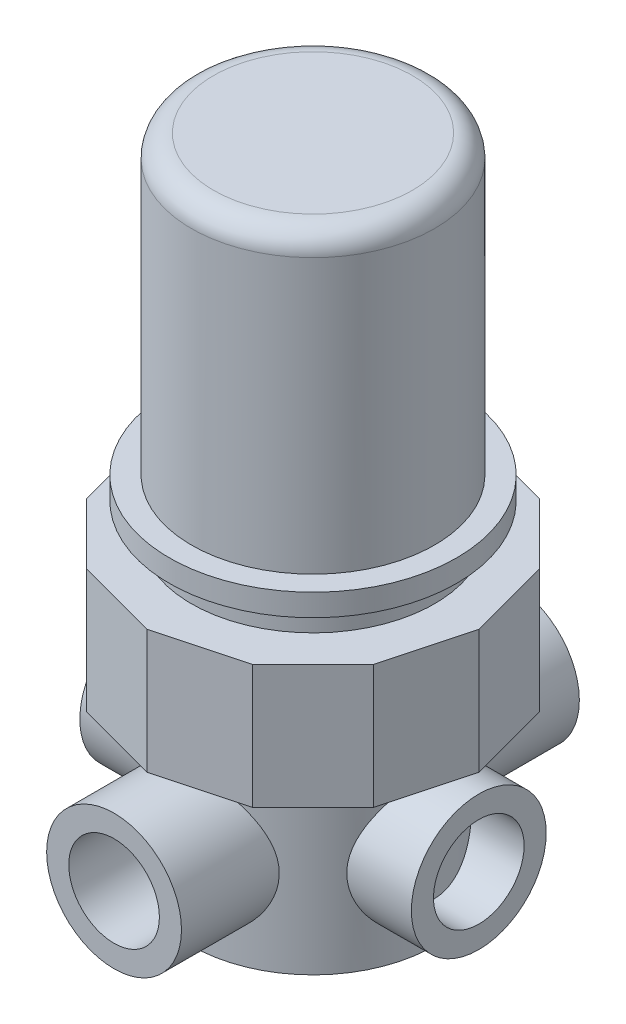
from build123d import *

# Parameters (mm, degrees)
CUT_EXTRUDE1_START  = -14.224
CUT_EXTRUDE1_DEPTH  = 14.224
SKETCH3_R           = 7.747
SKETCH3_R_2         = 5.207
BOSS_EXTRUDE1_DEPTH = 8.89
CIRPATTERN1_COUNT   = 4
SKETCH4_R           = 7.747
CUT_EXTRUDE2_DEPTH  = 3.81
FILLET1_R           = 2.54


with BuildPart() as part:
    # Sketch1 → Revolve1 (revolve)
    with BuildSketch(Plane.XY, mode=Mode.PRIVATE) as revolve1_sk:
        Polygon((0, 73.914), (13.97, 73.914), (13.97, 39.878), (16.51, 39.878), (16.51, 37.338), (13.97, 37.338), (13.97, 34.036), (19.05, 34.036), (19.05, 19.812), (13.97, 19.812), (13.97, 0), (0, 0), align=None)
    revolve(revolve1_sk.sketch.rotate(Axis((0, 73.914, 0), (0, -1, 0)), 180), axis=Axis((0, 73.914, 0), (0, -1, 0)))

    # Sketch2 → Cut-Extrude1 (cut)
    with BuildSketch(Plane(origin=(0, 34.036, 0), x_dir=(1, 0, 0), z_dir=(0, 1, 0)).offset(CUT_EXTRUDE1_START)):
        with BuildLine():
            ThreePointArc((9.525, 16.497783942), (4.930502809, 18.400886991), (0, 19.05))
            Line((0, 19.05), (9.525, 16.497783942))
        make_face()
        with BuildLine():
            Line((-9.525, 16.497783942), (0, 19.05))
            ThreePointArc((0, 19.05), (-4.930502809, 18.400886991), (-9.525, 16.497783942))
        make_face()
        with BuildLine():
            Line((-16.497783942, 9.525), (-9.525, 16.497783942))
            ThreePointArc((-9.525, 16.497783942), (-13.470384182, 13.470384182), (-16.497783942, 9.525))
        make_face()
        with BuildLine():
            ThreePointArc((16.497783942, 9.525), (13.470384182, 13.470384182), (9.525, 16.497783942))
            Line((9.525, 16.497783942), (16.497783942, 9.525))
        make_face()
        with BuildLine():
            Line((-19.05, 0), (-16.497783942, 9.525))
            ThreePointArc((-16.497783942, 9.525), (-18.400886991, 4.930502809), (-19.05, 0))
        make_face()
        with BuildLine():
            ThreePointArc((19.05, 0), (18.400886991, 4.930502809), (16.497783942, 9.525))
            Line((16.497783942, 9.525), (19.05, 0))
        make_face()
        with BuildLine():
            Line((-16.497783942, -9.525), (-19.05, 0))
            ThreePointArc((-19.05, 0), (-18.400886991, -4.930502809), (-16.497783942, -9.525))
        make_face()
        with BuildLine():
            ThreePointArc((16.497783942, -9.525), (18.400886991, -4.930502809), (19.05, 0))
            Line((19.05, 0), (16.497783942, -9.525))
        make_face()
        with BuildLine():
            Line((-9.525, -16.497783942), (-16.497783942, -9.525))
            ThreePointArc((-16.497783942, -9.525), (-13.470384182, -13.470384182), (-9.525, -16.497783942))
        make_face()
        with BuildLine():
            ThreePointArc((9.525, -16.497783942), (13.470384182, -13.470384182), (16.497783942, -9.525))
            Line((16.497783942, -9.525), (9.525, -16.497783942))
        make_face()
        with BuildLine():
            Line((0, -19.05), (-9.525, -16.497783942))
            ThreePointArc((-9.525, -16.497783942), (-4.930502809, -18.400886991), (0, -19.05))
        make_face()
        with BuildLine():
            ThreePointArc((0, -19.05), (4.930502809, -18.400886991), (9.525, -16.497783942))
            Line((9.525, -16.497783942), (0, -19.05))
        make_face()
    extrude(amount=CUT_EXTRUDE1_DEPTH, mode=Mode.SUBTRACT)

    # Sketch3 → Boss-Extrude1 (add, symmetric)
    with BuildSketch(Plane.XY.offset(13.97)):
        with Locations(Location((0, 9.906, 0), (0, 0, 180))):
            Circle(SKETCH3_R)
        with Locations((0, 9.906)):
            Circle(SKETCH3_R_2, mode=Mode.SUBTRACT)
    boss_extrude1 = extrude(amount=BOSS_EXTRUDE1_DEPTH, both=True)

    # CirPattern1: Boss-Extrude1 ×4 about axis
    cirpattern1_axis = Axis((0, 0, 0), (0, 1, 0))
    for i in range(1, CIRPATTERN1_COUNT):
        add(boss_extrude1.rotate(cirpattern1_axis, i * 360 / CIRPATTERN1_COUNT))

    # Sketch4 → Cut-Extrude2 (cut)
    with BuildSketch(Plane(origin=(22.86, 0, 0), x_dir=(0, 0, -1), z_dir=(1, 0, 0))):
        with Locations(Location((0, 9.906, 0), (0, 0, 180))):
            Circle(SKETCH4_R)
    cut_extrude2 = extrude(amount=-CUT_EXTRUDE2_DEPTH, mode=Mode.SUBTRACT)

    # Mirror2: Cut-Extrude2 across plane
    add(cut_extrude2.mirror(Plane(origin=(0, 0, 0), x_dir=(0, 0, 1), z_dir=(1, 0, 0))), mode=Mode.SUBTRACT)

    # Fillet1
    fillet1_edges = [part.edges().sort_by_distance(p)[0] for p in [
        (13.97, 73.914, 0),
    ]]
    fillet(fillet1_edges, radius=FILLET1_R)


solid = part.part
